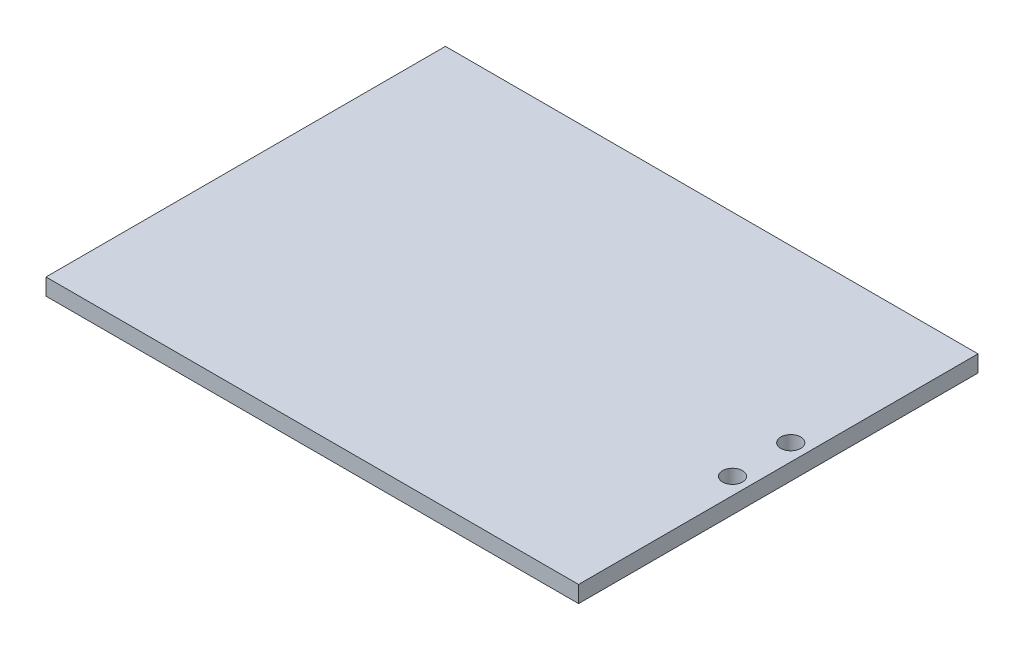
from build123d import *

# Parameters (mm, degrees)
SKETCH1_W                 = 101.6
SKETCH1_H                 = 76.2
BOSS_EXTRUDE1_DEPTH       = 3.175
F_6_CLEARANCE_HOLE1_D     = 3.7973
F_6_CLEARANCE_HOLE1_DEPTH = 12.7
F_6_CLEARANCE_HOLE1_TIP   = 1.140824014


with BuildPart() as part:
    # Sketch1 → Boss-Extrude1 (new body)
    with BuildSketch(Plane(origin=(0, 0, 0), x_dir=(1, 0, 0), z_dir=(0, 1, 0))):
        Rectangle(SKETCH1_W, SKETCH1_H)
    extrude(amount=BOSS_EXTRUDE1_DEPTH)

    # #6 Clearance Hole1
    with Locations(Plane(origin=(0, 3.175, 0), x_dir=(1, 0, 0), z_dir=(0, 1, 0))):
        with Locations((47.625, 5.55625), (47.625, -5.55625)):
            Hole(F_6_CLEARANCE_HOLE1_D / 2, depth=F_6_CLEARANCE_HOLE1_DEPTH)
            with Locations((0, 0, -(F_6_CLEARANCE_HOLE1_DEPTH + F_6_CLEARANCE_HOLE1_TIP / 2))):  # 118° drill point
                Cone(0, F_6_CLEARANCE_HOLE1_D / 2, F_6_CLEARANCE_HOLE1_TIP, mode=Mode.SUBTRACT)


solid = part.part
